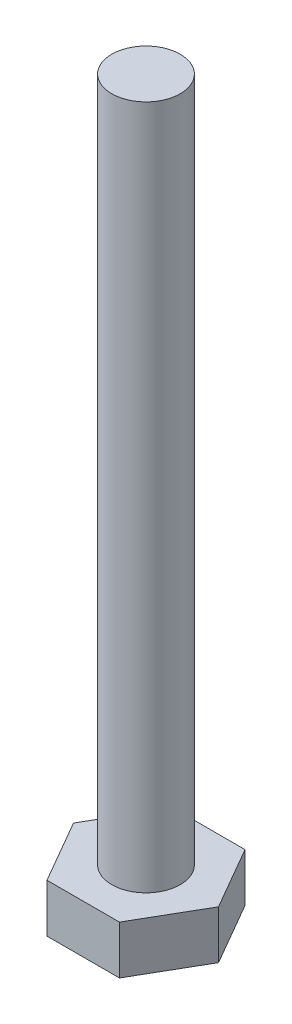
from build123d import *

# Parameters (mm, degrees)
SKETCH_1_R      = 1.5
EXTRUDE_1_DEPTH = 30
EXTRUDE_2_DEPTH = 2.12


with BuildPart() as part:
    # 草图1 → 凸台-拉伸1 (new body)
    with BuildSketch(Plane(origin=(0, 0, 0), x_dir=(1, 0, 0), z_dir=(0, 1, 0))):
        with Locations(Location((0, 0, 0), (0, 0, 270))):
            Circle(SKETCH_1_R)
    extrude(amount=EXTRUDE_1_DEPTH)

    # 草图3 → 凸台-拉伸2 (add)
    with BuildSketch(Plane.XZ):
        Polygon((3.175426481, 0), (1.58771324, 2.75), (-1.58771324, 2.75), (-3.175426481, 0), (-1.58771324, -2.75), (1.58771324, -2.75), align=None)
    extrude(amount=EXTRUDE_2_DEPTH)


solid = part.part
